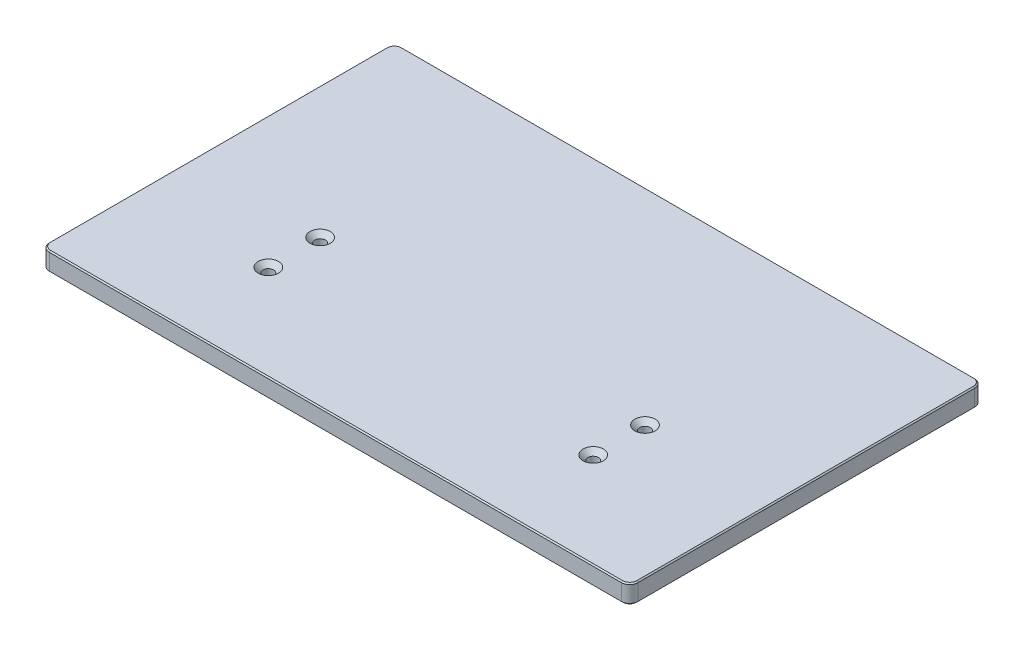
from build123d import *

# Parameters (mm, degrees)
SKETCH1_W                                       = 500
SKETCH1_H                                       = 300
BOSS_EXTRUDE1_DEPTH                             = 15.875
FILLET1_R                                       = 7
CHAMFER4_SIZE                                   = 1
CSK_FOR_M8_FLAT_HEAD_MACHINE_SCREW1_D           = 9
CSK_FOR_M8_FLAT_HEAD_MACHINE_SCREW1_CSINK_D     = 17.3
CSK_FOR_M8_FLAT_HEAD_MACHINE_SCREW1_CSINK_ANGLE = 90


with BuildPart() as part:
    # Sketch1 → Boss-Extrude1 (new body)
    with BuildSketch(Plane(origin=(0, 0, 0), x_dir=(1, 0, 0), z_dir=(0, 1, 0))):
        Rectangle(SKETCH1_W, SKETCH1_H)
    extrude(amount=BOSS_EXTRUDE1_DEPTH)

    # Fillet1
    fillet1_edges = [part.edges().sort_by_distance(p)[0] for p in [
        (250, 7.9375, 150),
        (-250, 7.9375, 150),
        (-250, 7.9375, -150),
        (250, 7.9375, -150),
    ]]
    fillet(fillet1_edges, radius=FILLET1_R)

    # Chamfer4
    chamfer4_edges = [part.edges().sort_by_distance(p)[0] for p in [
        (-250, 0, 0),
        (-250, 15.875, 0),
        (250, 0, 0),
        (0, 0, 150),
        (0, 0, -150),
        (-247.949747468, 0, 147.949747468),
        (247.949747468, 0, 147.949747468),
        (247.949747468, 0, -147.949747468),
        (-247.949747468, 0, -147.949747468),
        (0, 15.875, -150),
        (250, 15.875, 0),
        (0, 15.875, 150),
        (-247.949747468, 15.875, 147.949747468),
        (247.949747468, 15.875, 147.949747468),
        (247.949747468, 15.875, -147.949747468),
        (-247.949747468, 15.875, -147.949747468),
    ]]
    chamfer(chamfer4_edges, length=CHAMFER4_SIZE)

    # CSK for M8 Flat Head Machine Screw1 (through all)
    with Locations(Plane(origin=(0, 15.875, 0), x_dir=(1, 0, 0), z_dir=(0, 1, 0))):
        with Locations((138, -25), (138, -69)):
            csk_for_m8_flat_head_machine_screw1 = CounterSinkHole(CSK_FOR_M8_FLAT_HEAD_MACHINE_SCREW1_D / 2, CSK_FOR_M8_FLAT_HEAD_MACHINE_SCREW1_CSINK_D / 2, counter_sink_angle=CSK_FOR_M8_FLAT_HEAD_MACHINE_SCREW1_CSINK_ANGLE)

    # Mirror3: CSK for M8 Flat Head Machine Screw1 across plane
    add(csk_for_m8_flat_head_machine_screw1.mirror(Plane(origin=(0, 0, 0), x_dir=(0, 0, 1), z_dir=(1, 0, 0))), mode=Mode.SUBTRACT)


solid = part.part
